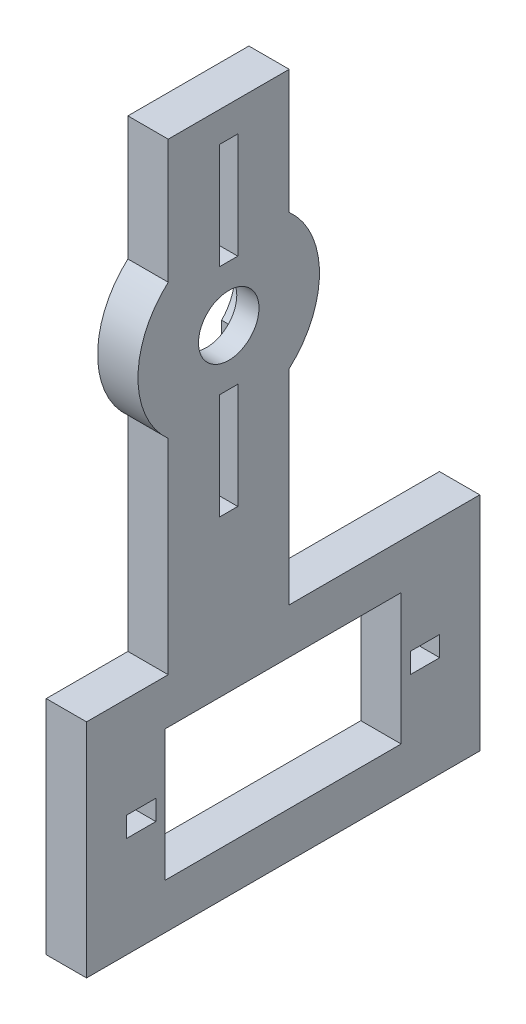
from build123d import *

# Parameters (mm, degrees)
BOSS_EXTRUDE1_START  = 55.6
SKETCH1_R            = 9
BOSS_EXTRUDE1_DEPTH  = 4
BOSS_EXTRUDE2_START  = -58
SKETCH2_W            = 4
SKETCH2_H            = 49
BOSS_EXTRUDE2_DEPTH  = 12
BOSS_EXTRUDE3_START  = -76.9
SKETCH3_W            = 4
SKETCH3_H            = 22
BOSS_EXTRUDE3_DEPTH  = 39
BOSS_EXTRUDE4_START  = 55.1
SKETCH4_R            = 4.6
BOSS_EXTRUDE4_DEPTH  = 2.3
BOSS_EXTRUDE5_START  = -55.3
SKETCH5_W            = 2.3
SKETCH5_H            = 17.5
BOSS_EXTRUDE5_DEPTH  = 6.6
BOSS_EXTRUDE6_START  = -52.9
SKETCH6_W            = 6
SKETCH6_H            = 10.5
BOSS_EXTRUDE6_DEPTH  = 1.8
BOSS_EXTRUDE7_START  = -55.3
SKETCH7_W            = 2.3
SKETCH7_H            = 17.5
BOSS_EXTRUDE7_DEPTH  = 6.6
BOSS_EXTRUDE8_START  = -52.9
SKETCH8_W            = 6
SKETCH8_H            = 10.5
BOSS_EXTRUDE8_DEPTH  = 1.8
BOSS_EXTRUDE9_START  = 54.6
SKETCH9_R            = 3
BOSS_EXTRUDE9_DEPTH  = 6
BOSS_EXTRUDE10_START = -69.1
SKETCH10_W           = 6
SKETCH10_H           = 13
BOSS_EXTRUDE10_DEPTH = 23.4
BOSS_EXTRUDE11_START = -72.925
SKETCH11_W           = 6
SKETCH11_H           = 2
BOSS_EXTRUDE11_DEPTH = 2.9
BOSS_EXTRUDE12_START = -44.775
SKETCH12_W           = 6
SKETCH12_H           = 2
BOSS_EXTRUDE12_DEPTH = 2.9


with BuildPart() as part:
    # Sketch1 → Boss-Extrude1 (new body)
    with BuildSketch(Plane(origin=(0, 0, 0), x_dir=(0, 0, -1), z_dir=(1, 0, 0)).offset(BOSS_EXTRUDE1_START)):
        with Locations((52, 18)):
            Circle(SKETCH1_R)
    extrude(amount=BOSS_EXTRUDE1_DEPTH)

    # Sketch2 → Boss-Extrude2 (add)
    with BuildSketch(Plane.XY.offset(BOSS_EXTRUDE2_START)):
        with Locations((57.6, 12.5)):
            Rectangle(SKETCH2_W, SKETCH2_H)
    extrude(amount=BOSS_EXTRUDE2_DEPTH)

    # Sketch3 → Boss-Extrude3 (add)
    with BuildSketch(Plane.XY.offset(BOSS_EXTRUDE3_START)):
        with Locations((57.6, -20)):
            Rectangle(SKETCH3_W, SKETCH3_H)
    extrude(amount=BOSS_EXTRUDE3_DEPTH)


with BuildPart() as body_2:
    # Sketch4 → Boss-Extrude4 (new body)
    with BuildSketch(Plane(origin=(0, 0, 0), x_dir=(0, 0, -1), z_dir=(1, 0, 0)).offset(BOSS_EXTRUDE4_START)):
        with Locations((52, 18)):
            Circle(SKETCH4_R)
    extrude(amount=BOSS_EXTRUDE4_DEPTH)


with BuildPart() as part_1:
    add(part.part)

    # Combine1: cut body 2
    add(body_2.part, mode=Mode.SUBTRACT)


with BuildPart() as body_2_2:
    # Sketch5 → Boss-Extrude5 (new body)
    with BuildSketch(Plane.XY.offset(BOSS_EXTRUDE5_START)):
        with Locations((56.25, 26.75)):
            Rectangle(SKETCH5_W, SKETCH5_H)
    extrude(amount=BOSS_EXTRUDE5_DEPTH)


with BuildPart() as part_2:
    add(part_1.part)

    # Combine2: cut body 2 2
    add(body_2_2.part, mode=Mode.SUBTRACT)


with BuildPart() as body_2_3:
    # Sketch6 → Boss-Extrude6 (new body)
    with BuildSketch(Plane.XY.offset(BOSS_EXTRUDE6_START)):
        with Locations((57.6, 28.75)):
            Rectangle(SKETCH6_W, SKETCH6_H)
    extrude(amount=BOSS_EXTRUDE6_DEPTH)


with BuildPart() as part_3:
    add(part_2.part)

    # Combine3: cut body 2 3
    add(body_2_3.part, mode=Mode.SUBTRACT)


with BuildPart() as body_2_4:
    # Sketch7 → Boss-Extrude7 (new body)
    with BuildSketch(Plane.XY.offset(BOSS_EXTRUDE7_START)):
        with Locations((56.25, 9.25)):
            Rectangle(SKETCH7_W, SKETCH7_H)
    extrude(amount=BOSS_EXTRUDE7_DEPTH)


with BuildPart() as part_4:
    add(part_3.part)

    # Combine4: cut body 2 4
    add(body_2_4.part, mode=Mode.SUBTRACT)


with BuildPart() as body_2_5:
    # Sketch8 → Boss-Extrude8 (new body)
    with BuildSketch(Plane.XY.offset(BOSS_EXTRUDE8_START)):
        with Locations((57.6, 7.25)):
            Rectangle(SKETCH8_W, SKETCH8_H)
    extrude(amount=BOSS_EXTRUDE8_DEPTH)


with BuildPart() as part_5:
    add(part_4.part)

    # Combine5: cut body 2 5
    add(body_2_5.part, mode=Mode.SUBTRACT)


with BuildPart() as body_2_6:
    # Sketch9 → Boss-Extrude9 (new body)
    with BuildSketch(Plane(origin=(0, 0, 0), x_dir=(0, 0, -1), z_dir=(1, 0, 0)).offset(BOSS_EXTRUDE9_START)):
        with Locations((52, 18)):
            Circle(SKETCH9_R)
    extrude(amount=BOSS_EXTRUDE9_DEPTH)


with BuildPart() as part_6:
    add(part_5.part)

    # Combine6: cut body 2 6
    add(body_2_6.part, mode=Mode.SUBTRACT)


with BuildPart() as body_2_7:
    # Sketch10 → Boss-Extrude10 (new body)
    with BuildSketch(Plane.XY.offset(BOSS_EXTRUDE10_START)):
        with Locations((57.6, -20)):
            Rectangle(SKETCH10_W, SKETCH10_H)
    extrude(amount=BOSS_EXTRUDE10_DEPTH)


with BuildPart() as part_7:
    add(part_6.part)

    # Combine7: cut body 2 7
    add(body_2_7.part, mode=Mode.SUBTRACT)


with BuildPart() as body_2_8:
    # Sketch11 → Boss-Extrude11 (new body)
    with BuildSketch(Plane.XY.offset(BOSS_EXTRUDE11_START)):
        with Locations((57.6, -20)):
            Rectangle(SKETCH11_W, SKETCH11_H)
    extrude(amount=BOSS_EXTRUDE11_DEPTH)


with BuildPart() as part_8:
    add(part_7.part)

    # Combine8: cut body 2 8
    add(body_2_8.part, mode=Mode.SUBTRACT)


with BuildPart() as body_2_9:
    # Sketch12 → Boss-Extrude12 (new body)
    with BuildSketch(Plane.XY.offset(BOSS_EXTRUDE12_START)):
        with Locations((57.6, -20)):
            Rectangle(SKETCH12_W, SKETCH12_H)
    extrude(amount=BOSS_EXTRUDE12_DEPTH)


with BuildPart() as part_9:
    add(part_8.part)

    # Combine9: cut body 2 9
    add(body_2_9.part, mode=Mode.SUBTRACT)


solid = part_9.part
